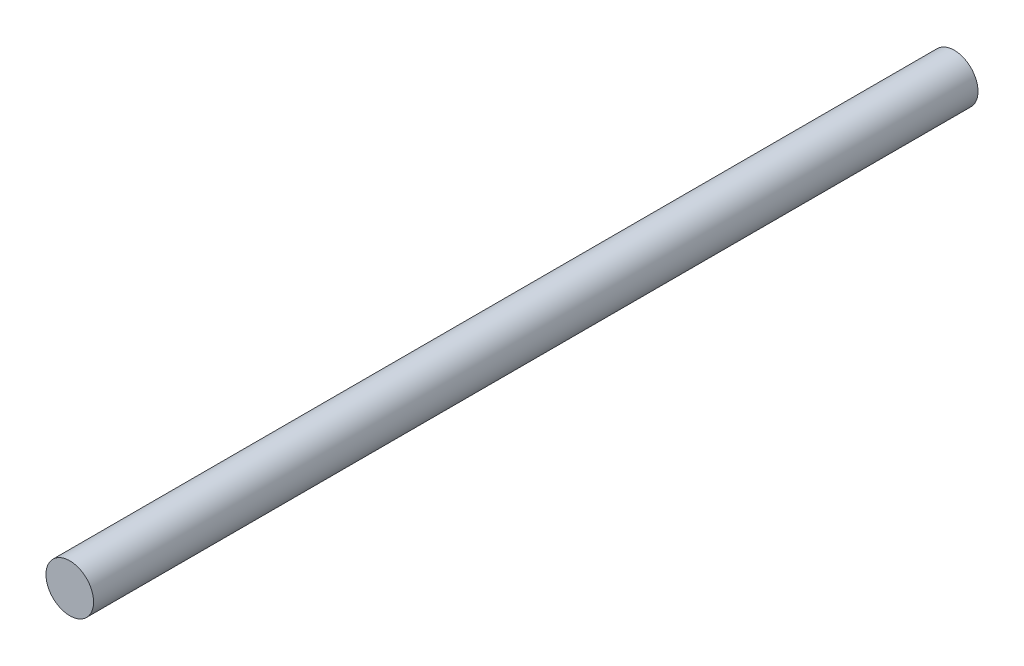
from build123d import *

# Parameters (mm, degrees)
SKETCH1_R           = 4
BOSS_EXTRUDE1_DEPTH = 148.5


with BuildPart() as part:
    # Sketch1 → Boss-Extrude1 (new body)
    with BuildSketch(Plane.XY):
        Circle(SKETCH1_R)
    extrude(amount=BOSS_EXTRUDE1_DEPTH)


solid = part.part
